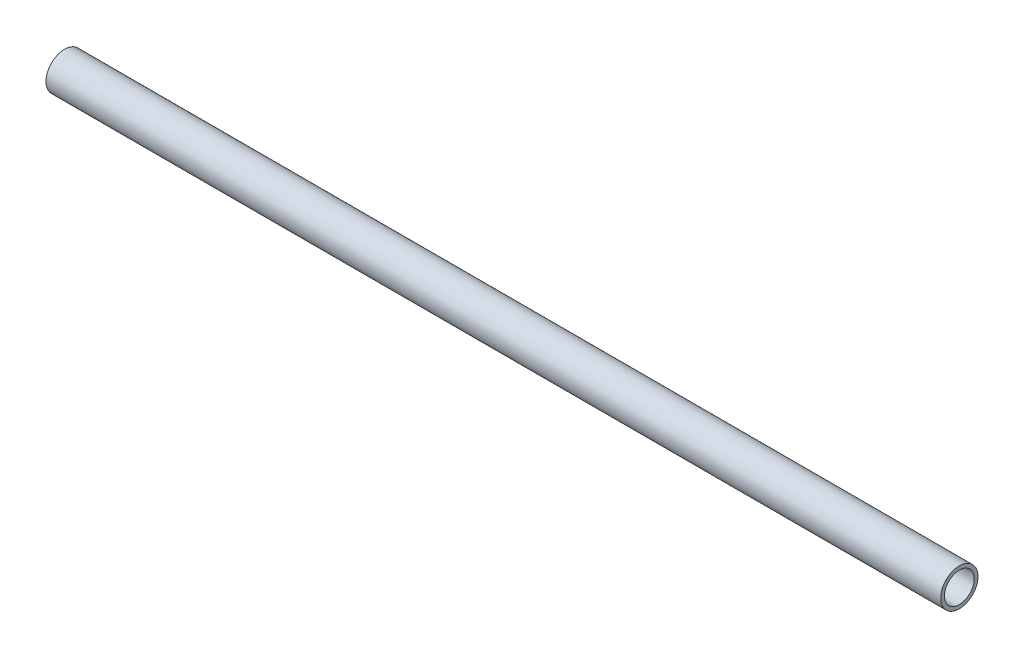
from build123d import *

# Parameters (mm, degrees)
SKETCH1_R           = 7.9375
SKETCH1_R_2         = 6.35
BOSS_EXTRUDE1_DEPTH = 190.5


with BuildPart() as part:
    # Sketch1 → Boss-Extrude1 (new, symmetric)
    with BuildSketch(Plane(origin=(0, 0, 0), x_dir=(0, 0, -1), z_dir=(1, 0, 0))):
        Circle(SKETCH1_R)
        Circle(SKETCH1_R_2, mode=Mode.SUBTRACT)
    extrude(amount=BOSS_EXTRUDE1_DEPTH, both=True)


solid = part.part
